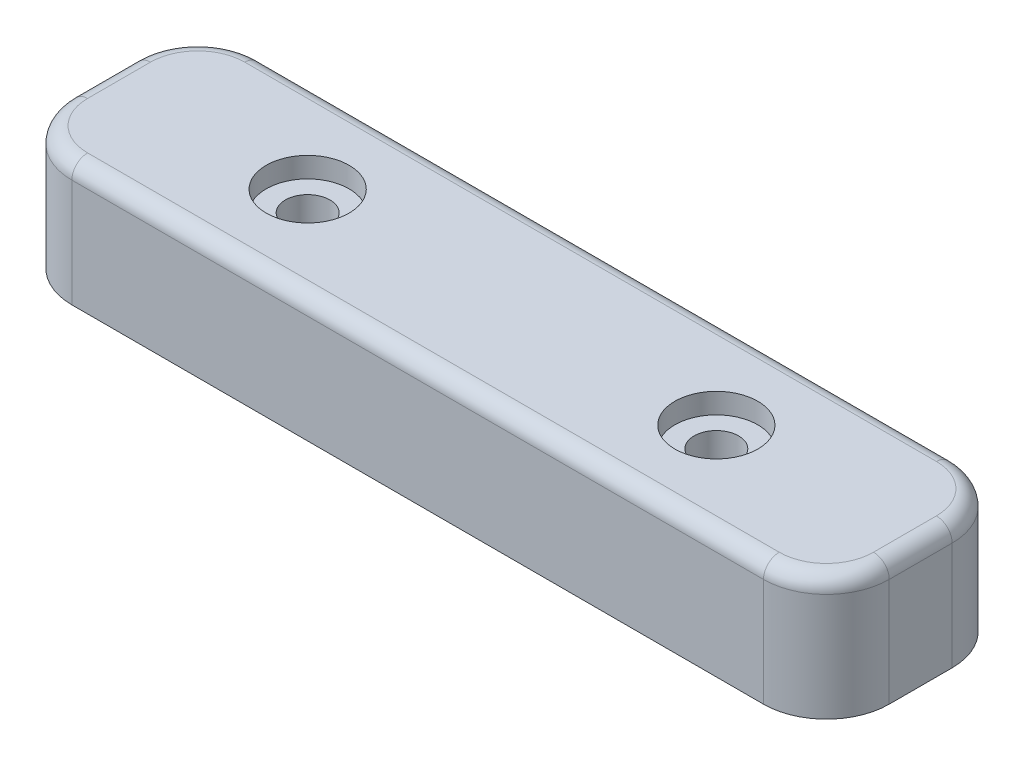
from build123d import *

# Parameters (mm, degrees)
SKETCH1_W                       = 66.04
SKETCH1_H                       = 15.24
BOSS_EXTRUDE1_DEPTH             = 10
CBORE_FOR_M3_SBHCS1_D           = 3.6
CBORE_FOR_M3_SBHCS1_CBORE_D     = 6.7
CBORE_FOR_M3_SBHCS1_CBORE_DEPTH = 1.65
FILLET1_R                       = 5.08
FILLET2_R                       = 1.27


with BuildPart() as part:
    # Sketch1 → Boss-Extrude1 (new body)
    with BuildSketch(Plane(origin=(0, 0, 0), x_dir=(1, 0, 0), z_dir=(0, 1, 0))):
        with Locations((33.02, -7.62)):
            Rectangle(SKETCH1_W, SKETCH1_H)
    extrude(amount=BOSS_EXTRUDE1_DEPTH)

    # CBORE for M3 SBHCS1 (through all)
    with Locations(Plane(origin=(0, 10, 0), x_dir=(1, 0, 0), z_dir=(0, 1, 0))):
        with Locations((16.51, -7.62), (49.53, -7.62)):
            CounterBoreHole(CBORE_FOR_M3_SBHCS1_D / 2, CBORE_FOR_M3_SBHCS1_CBORE_D / 2, CBORE_FOR_M3_SBHCS1_CBORE_DEPTH)

    # Fillet1
    fillet1_edges = [part.edges().sort_by_distance(p)[0] for p in [
        (0, 5, 0),
        (66.04, 5, 0),
        (66.04, 5, 15.24),
        (0, 5, 15.24),
    ]]
    fillet(fillet1_edges, radius=FILLET1_R)

    # Fillet2
    fillet2_edges = [part.edges().sort_by_distance(p)[0] for p in [
        (33.02, 10, 15.24),
        (0, 10, 7.62),
        (66.04, 10, 7.62),
        (33.02, 10, 0),
        (64.552102448, 10, 1.487897552),
        (64.552102448, 10, 13.752102448),
        (1.487897552, 10, 1.487897552),
        (1.487897552, 10, 13.752102448),
    ]]
    fillet(fillet2_edges, radius=FILLET2_R)


solid = part.part
